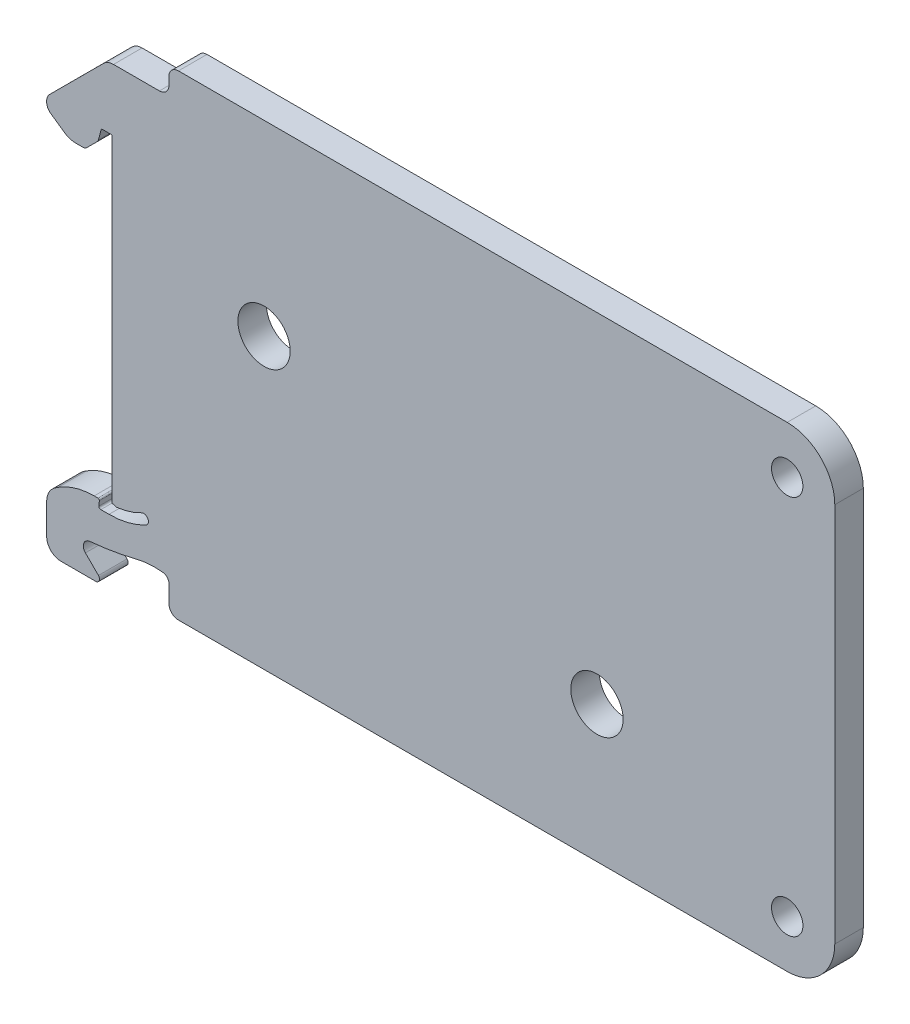
from build123d import *

# Parameters (mm, degrees)
SKETCH1_R                       = 2.75
BOSS_EXTRUDE1_DEPTH             = 3
BOSS_EXTRUDE2_START             = -3
SKETCH2_W                       = 70
SKETCH2_H                       = 50
SKETCH2_R                       = 2.75
BOSS_EXTRUDE2_DEPTH             = 3
FILLET1_R                       = 5
TAP_DRILL_FOR_M4X0_7_TAP1_D     = 3.3
TAP_DRILL_FOR_M4X0_7_TAP1_DEPTH = 5
TAP_DRILL_FOR_M4X0_7_TAP1_TIP   = 0.991420021
FILLET2_R                       = 1


with BuildPart() as part:
    # Sketch1 → Boss-Extrude1 (new body)
    with BuildSketch(Plane.XY):
        with BuildLine():
            Line((-27.5, 40.954554701), (-27.5, 43.77942119))
            ThreePointArc((-27.5, 43.77942119), (-27.675848554, 44.243388065), (-28.115043604, 44.474246643))
            ThreePointArc((-28.115043604, 44.474246643), (-29.494269709, 44.515011098), (-30.857622009, 44.302415486))
            ThreePointArc((-30.857622009, 44.302415486), (-33.320623763, 43.783640888), (-35.816700763, 43.459442898))
            ThreePointArc((-35.816700763, 43.459442898), (-36.454446159, 42.968046035), (-36.279664044, 42.182144463))
            Line((-36.279664044, 42.182144463), (-34.910050506, 40.812530925))
            ThreePointArc((-34.910050506, 40.812530925), (-34.823341406, 40.37661484), (-35.192893219, 40.129688213))
            Line((-35.192893219, 40.129688213), (-38.85, 40.129688213))
            ThreePointArc((-38.85, 40.129688213), (-39.910660172, 40.569028041), (-40.35, 41.629688213))
            Line((-40.35, 41.629688213), (-40.35, 44.839311769))
            ThreePointArc((-40.35, 44.839311769), (-40.127638883, 45.755826908), (-39.51, 46.468544718))
            ThreePointArc((-39.51, 46.468544718), (-39.333648382, 46.591125418), (-39.154570787, 46.709688213))
            ThreePointArc((-39.154570787, 46.709688213), (-37.336364984, 47.543852346), (-35.356465997, 47.829688213))
            Line((-35.356465997, 47.829688213), (-34.963696275, 47.829688213))
            ThreePointArc((-34.963696275, 47.829688213), (-34.853104675, 47.781026744), (-34.81426707, 47.666614851))
            Line((-34.81426707, 47.666614851), (-34.859717037, 47.147119361))
            ThreePointArc((-34.859717037, 47.147119361), (-34.807933564, 46.994570171), (-34.660478097, 46.929688213))
            Line((-34.660478097, 46.929688213), (-33.8, 46.929688213))
            ThreePointArc((-33.8, 46.929688213), (-31.798990845, 47.174505883), (-29.916025641, 47.89451656))
            ThreePointArc((-29.916025641, 47.89451656), (-29.70812219, 48.570368729), (-30.383974359, 48.778272181))
            ThreePointArc((-30.383974359, 48.778272181), (-31.625663196, 48.261025539), (-32.941176471, 47.980383271))
            ThreePointArc((-32.941176471, 47.980383271), (-33.129888119, 47.994076587), (-33.3, 48.076911006))
            Line((-33.3, 48.076911006), (-33.5, 48.076911006))
            Line((-33.5, 48.076911006), (-33.5, 81.629688213))
            Line((-33.5, 81.629688213), (-34.6, 81.629688213))
            Line((-34.6, 81.629688213), (-34.913048957, 80.461373602))
            ThreePointArc((-34.913048957, 80.461373602), (-34.962999168, 80.340783124), (-35.042458479, 80.237229734))
            Line((-35.042458479, 80.237229734), (-36.153553391, 79.126134822))
            ThreePointArc((-36.153553391, 79.126134822), (-36.315765065, 79.017748447), (-36.507106781, 78.979688213))
            Line((-36.507106781, 78.979688213), (-37.319402422, 78.979688213))
            ThreePointArc((-37.319402422, 78.979688213), (-37.920814021, 79.072254311), (-38.466555295, 79.341384124))
            Line((-38.466555295, 79.341384124), (-39.923576436, 80.361601311))
            ThreePointArc((-39.923576436, 80.361601311), (-40.237010833, 80.719004742), (-40.35, 81.180753355))
            Line((-40.35, 81.180753355), (-40.35, 81.315474651))
            ThreePointArc((-40.35, 81.315474651), (-40.273784436, 81.698387585), (-40.05675537, 82.022932669))
            Line((-40.05675537, 82.022932669), (-34.383177792, 87.69087524))
            ThreePointArc((-34.383177792, 87.69087524), (-33.896725598, 88.01565007), (-33.323044738, 88.129688213))
            Line((-33.323044738, 88.129688213), (-27.5, 88.129688213))
            Line((-27.5, 88.129688213), (-27.5, 90.954554701))
            Line((-27.5, 90.954554701), (22.5, 90.954554701))
            Line((22.5, 90.954554701), (22.5, 40.954554701))
            Line((22.5, 40.954554701), (-27.5, 40.954554701))
        make_face()
        with Locations((-17.5, 71.3)):
            Circle(SKETCH1_R, mode=Mode.SUBTRACT)
        with Locations((17.5, 55.3)):
            Circle(SKETCH1_R, mode=Mode.SUBTRACT)
    extrude(amount=BOSS_EXTRUDE1_DEPTH)

    # Sketch2 → Boss-Extrude2 (add)
    with BuildSketch(Plane.XY.offset(3).offset(BOSS_EXTRUDE2_START)):
        with Locations((7.5, 65.954554701)):
            Rectangle(SKETCH2_W, SKETCH2_H)
        with Locations((-17.5, 71.3)):
            Circle(SKETCH2_R, mode=Mode.SUBTRACT)
        with Locations((17.5, 55.3)):
            Circle(SKETCH2_R, mode=Mode.SUBTRACT)
    extrude(amount=BOSS_EXTRUDE2_DEPTH)

    # Fillet1
    fillet1_edges = [part.edges().sort_by_distance(p)[0] for p in [
        (42.5, 40.954554701, 1.5),
        (42.5, 90.954554701, 1.5),
    ]]
    fillet(fillet1_edges, radius=FILLET1_R)

    # Tap Drill for M4x0.7 Tap1
    with Locations(Plane.XY.offset(3)):
        with Locations((37.5, 45.954554701), (37.5, 85.954554701)):
            Hole(TAP_DRILL_FOR_M4X0_7_TAP1_D / 2, depth=TAP_DRILL_FOR_M4X0_7_TAP1_DEPTH)
            with Locations((0, 0, -(TAP_DRILL_FOR_M4X0_7_TAP1_DEPTH + TAP_DRILL_FOR_M4X0_7_TAP1_TIP / 2))):  # 118° drill point
                Cone(0, TAP_DRILL_FOR_M4X0_7_TAP1_D / 2, TAP_DRILL_FOR_M4X0_7_TAP1_TIP, mode=Mode.SUBTRACT)

    # Fillet2
    fillet2_edges = [part.edges().sort_by_distance(p)[0] for p in [
        (-27.5, 90.954554701, 1.5),
        (-27.5, 40.954554701, 1.5),
        (-27.5, 88.129688213, 1.5),
    ]]
    fillet(fillet2_edges, radius=FILLET2_R)


solid = part.part
